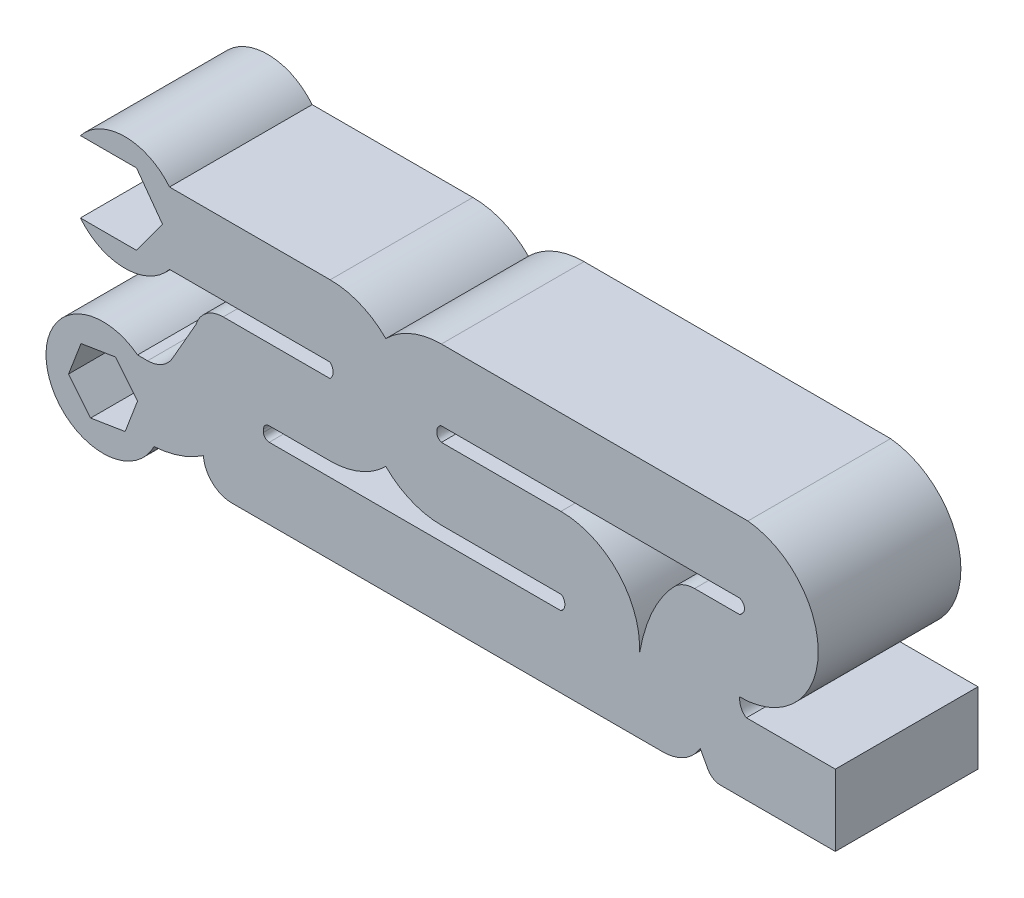
from build123d import *

# Parameters (mm, degrees)
BOSS_EXTRUDE1_DEPTH = 5
BOSS_EXTRUDE2_DEPTH = 5
BOSS_EXTRUDE4_DEPTH = 5
BOSS_EXTRUDE6_DEPTH = 5
SKETCH9_R           = 2
BOSS_EXTRUDE7_DEPTH = 5


with BuildPart() as part:
    # Sketch1 → Boss-Extrude1 (new body)
    with BuildSketch(Plane.XY):
        with BuildLine():
            Line((-4.859145774, 0.392452951), (-6.826544894, 0.392452951))
            ThreePointArc((-6.826544894, 0.392452951), (-3.265295394, 1.642452951), (-6.826544894, 2.892452951))
            Line((-6.826544894, 2.892452951), (-4.859145774, 2.892452951))
            Line((-4.859145774, 2.892452951), (-3.950967614, 1.642452951))
            Line((-3.950967614, 1.642452951), (-4.859145774, 0.392452951))
        make_face()
    extrude(amount=BOSS_EXTRUDE1_DEPTH)

    # Sketch2 → Boss-Extrude2 (add)
    with BuildSketch(Plane(origin=(0, 0, 0), x_dir=(-1, 0, 0), z_dir=(0, 0, -1))):
        with BuildLine():
            ThreePointArc((3.704045895, 0.392452951), (3.265295394, 1.642452951), (3.704045895, 2.892452951))
            Line((3.704045895, 2.892452951), (-1.927293689, 2.892452951))
            Line((-1.927293689, 2.892452951), (-1.927293689, 0.392452951))
            Line((-1.927293689, 0.392452951), (3.704045895, 0.392452951))
        make_face()
    extrude(amount=-BOSS_EXTRUDE2_DEPTH)

    # Sketch7 → Boss-Extrude4 (add)
    with BuildSketch(Plane(origin=(0, 0, 0), x_dir=(-1, 0, 0), z_dir=(0, 0, -1))):
        with BuildLine():
            ThreePointArc((-1.927293689, 2.892452951), (-4.011161168, 1.936887773), (-4.646831412, -0.265731537))
            ThreePointArc((-4.646831412, -0.265731537), (-4.049138928, -1.606910585), (-2.846528345, -2.449362561))
            ThreePointArc((-2.846528345, -2.449362561), (-2.393666578, -2.567712418), (-1.927293689, -2.607547049))
            Line((-1.927293689, -2.607547049), (-1.927293689, -0.107547049))
            add(Edge.make_bspline(
                [(-1.927293689, 0.392452951), (-2.027068627, 0.287688693), (-2.096009728, 0.076120474), (-1.927293689, -0.107547049)],
                knots=[0, 0, 0, 0, 1, 1, 1, 1], degree=3))
            Line((-1.927293689, 0.392452951), (-1.927293689, 2.892452951))
        make_face()
        with BuildLine():
            Line((-1.927293689, -0.107547049), (-1.927293689, -2.607547049))
            ThreePointArc((-1.927293689, -2.607547049), (-0.073244067, -1.88855665), (0.811319098, -0.107547049))
            Line((0.811319098, -0.107547049), (-1.927293689, -0.107547049))
        make_face()
        with BuildLine():
            Line((-5.566066067, -5.607547049), (1.516820501, -5.607547049))
            ThreePointArc((1.516820501, -5.607547049), (2.192724029, -5.344537158), (2.51308893, -4.69385589))
            Line((2.51308893, -4.69385589), (2.816301333, -1.19385589))
            ThreePointArc((2.816301333, -1.19385589), (2.557023013, -0.431643521), (1.820032904, -0.107547049))
            Line((1.820032904, -0.107547049), (0.811319098, -0.107547049))
            ThreePointArc((0.811319098, -0.107547049), (-0.073244067, -1.88855665), (-1.927293689, -2.607547049))
            Line((-1.927293689, -2.607547049), (0.210410566, -2.607547049))
            ThreePointArc((0.210410566, -2.607547049), (0.351831922, -2.666125693), (0.410410566, -2.807547049))
            Line((0.410410566, -2.807547049), (0.410410566, -2.907547049))
            ThreePointArc((0.410410566, -2.907547049), (0.351831922, -3.048968405), (0.210410566, -3.107547049))
            Line((0.210410566, -3.107547049), (-2.82745328, -3.107547049))
            Line((-2.82745328, -3.107547049), (-5.566066067, -3.107547049))
            Line((-5.566066067, -3.107547049), (-5.566066067, -5.607547049))
        make_face()
    extrude(amount=-BOSS_EXTRUDE4_DEPTH)

    # Sketch8 → Boss-Extrude6 (add)
    with BuildSketch(Plane(origin=(0, 0, 0), x_dir=(-1, 0, 0), z_dir=(0, 0, -1))):
        with BuildLine():
            Line((-10.013976401, -2.607547049), (-5.825134583, -2.607547049))
            ThreePointArc((-5.825134583, -2.607547049), (-3.075134583, 0.142452951), (-5.825134583, 2.892452951))
            Line((-5.825134583, 2.892452951), (-16.568194085, 2.892452951))
            ThreePointArc((-16.568194085, 2.892452951), (-19.02871008, 0.014266669), (-16.282434429, -2.592659737))
            add(Edge.make_bspline(
                [(-16.515824565, -3.107547049), (-16.307464717, -3.001414127), (-16.25870467, -2.690751367), (-16.282434429, -2.592659737)],
                knots=[0, 0, 0, 0, 1, 1, 1, 1], degree=3))
            Line((-16.515824565, -3.107547049), (-19.631835761, -3.107547049))
            Line((-19.631835761, -3.107547049), (-19.631835761, -5.607101349))
            Line((-19.631835761, -5.607101349), (-16.213002559, -5.607101349))
            Line((-16.213002559, -5.607101349), (-15.606969091, -5.607101349))
            ThreePointArc((-15.606969091, -5.607101349), (-15.351610534, -5.536975757), (-15.167880656, -5.346269377))
            Line((-15.167880656, -5.346269377), (-14.894043788, -4.843532439))
            ThreePointArc((-14.894043788, -4.843532439), (-14.343989393, -5.402533166), (-13.587014521, -5.607547049))
            Line((-13.587014521, -5.607547049), (-12.513976401, -5.607547049))
            Line((-12.513976401, -5.607547049), (-10.013976401, -5.607547049))
            Line((-10.013976401, -5.607547049), (-5.566066067, -5.607547049))
            Line((-5.566066067, -5.607547049), (-5.566066067, -3.107547049))
            Line((-5.566066067, -3.107547049), (-10.013976401, -3.107547049))
            add(Edge.make_bspline(
                [(-10.013976401, -3.107547049), (-10.219087549, -2.993746895), (-10.173628104, -2.655391711), (-10.013976401, -2.607547049)],
                knots=[0, 0, 0, 0, 1, 1, 1, 1], degree=3))
        make_face()
        with BuildLine():
            ThreePointArc((-10.013976401, -0.092659737), (-12.028194826, -0.96690939), (-12.765194219, -3.035295286))
            add(Edge.make_bspline(
                [(-12.765194219, -3.035295286), (-12.975821702, -1.859806275), (-13.402295233, -1.005750906), (-13.973446446, -0.404146587)],
                knots=[0.010692284, 0.010692284, 0.010692284, 0.010692284, 0.535473495, 0.535473495, 0.535473495, 0.535473495], degree=3))
            ThreePointArc((-13.973446446, -0.404146587), (-14.304026887, -0.17382538), (-14.698670302, -0.092659737))
            Line((-14.698670302, -0.092659737), (-16.282434429, -0.092659737))
            add(Edge.make_bspline(
                [(-16.282434429, 0.407340263), (-16.503590414, 0.314326842), (-16.500815382, 0.048327648), (-16.282434429, -0.092659737)],
                knots=[0, 0, 0, 0, 1, 1, 1, 1], degree=3))
            Line((-16.282434429, 0.407340263), (-8.563747371, 0.407340263))
            Line((-8.563747371, 0.407340263), (-5.825134583, 0.407340263))
            add(Edge.make_bspline(
                [(-5.825134583, 0.407340263), (-5.661105782, 0.377805029), (-5.562243404, 0.004958528), (-5.825134583, -0.092659737)],
                knots=[0, 0, 0, 0, 1, 1, 1, 1], degree=3))
            Line((-5.825134583, -0.092659737), (-10.013976401, -0.092659737))
        make_face(mode=Mode.SUBTRACT)
    extrude(amount=-BOSS_EXTRUDE6_DEPTH)

    # Sketch9 → Boss-Extrude7 (add)
    # profile 1 of 2: a face of its own
    with BuildSketch(Plane(origin=(0, 0, 0), x_dir=(-1, 0, 0), z_dir=(0, 0, -1))):
        with BuildLine():
            ThreePointArc((4.246387568, -5.256955873), (4.08434285, -3.906172489), (4.823858789, -2.764248492))
            Line((4.823858789, -2.764248492), (4.472208625, -2.764248492))
            ThreePointArc((4.472208625, -2.764248492), (3.970628521, -2.629359698), (3.604363487, -2.26108329))
            Line((3.604363487, -2.26108329), (2.776044941, -0.814219613))
            ThreePointArc((2.776044941, -0.814219613), (2.814457703, -1.002098868), (2.816301333, -1.19385589))
            Line((2.816301333, -1.19385589), (2.515486097, -4.66618525))
            ThreePointArc((2.515486097, -4.66618525), (3.341666009, -5.076630322), (4.246387568, -5.256955873))
        make_face()
    # profile 2 of 2: a face of its own
    with BuildSketch(Plane(origin=(0, 0, 0), x_dir=(-1, 0, 0), z_dir=(0, 0, -1))):
        with Locations((6.032742451, -4.357547049)):
            Circle(SKETCH9_R)
        Polygon((6.805727945, -3.407931817), (5.596844283, -3.213314358), (4.823858789, -4.16292959), (5.259756957, -5.307162281), (6.468640619, -5.501779739), (7.241626113, -4.552164507), align=None, mode=Mode.SUBTRACT)
    extrude(amount=-BOSS_EXTRUDE7_DEPTH)


solid = part.part
